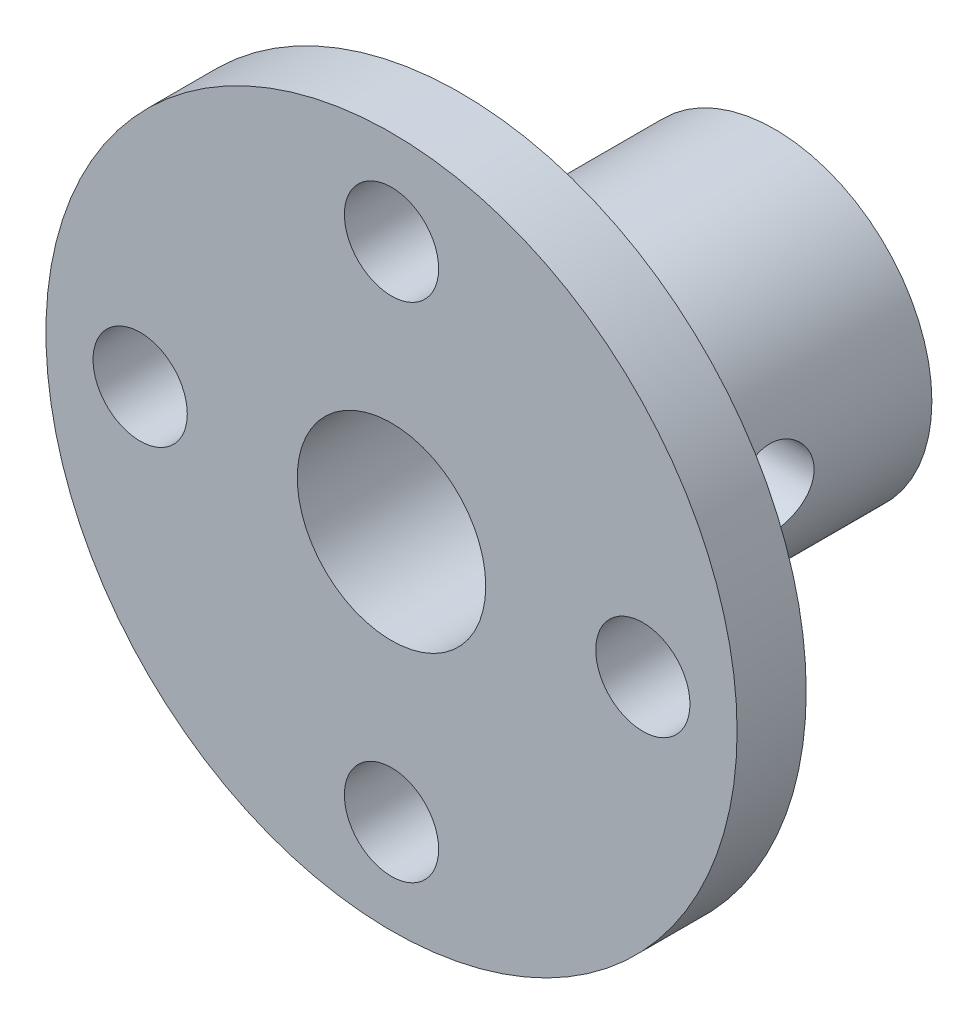
from build123d import *

# Parameters (mm, degrees)
SKETCH_1_R                           = 5
SKETCH_1_R_2                         = 3
HUB_OD10_ID6_L10_DEPTH               = 10
SKETCH_2_R                           = 11
SKETCH_2_R_2                         = 3
FLANGE_OD22_T2P2_DEPTH               = 2.2
SKETCH_3_R                           = 1.5
F_4XD3_ON_PCD16_DEPTH                = 2.2
SKETCH_4_R                           = 1.25
M3_GRUB_SCREW_RADIAL_REFERENCE_DEPTH = 2.1


with BuildPart() as part:
    # 草图1 → Hub_OD10_ID6_L10 (new body)
    with BuildSketch(Plane.XY):
        Circle(SKETCH_1_R)
        Circle(SKETCH_1_R_2, mode=Mode.SUBTRACT)
    extrude(amount=HUB_OD10_ID6_L10_DEPTH)

    # 草图2 → Flange_OD22_T2p2 (add)
    with BuildSketch(Plane.XY.offset(10)):
        Circle(SKETCH_2_R)
        Circle(SKETCH_2_R_2, mode=Mode.SUBTRACT)
    extrude(amount=FLANGE_OD22_T2P2_DEPTH)

    # 草图3 → 4xD3_on_PCD16 (cut)
    with BuildSketch(Plane.XY.offset(12.2)):
        with Locations((8, 0)):
            Circle(SKETCH_3_R)
        with Locations((0, 8)):
            Circle(SKETCH_3_R)
        with Locations((-8, 0)):
            Circle(SKETCH_3_R)
        with Locations((0, -8)):
            Circle(SKETCH_3_R)
    extrude(amount=-F_4XD3_ON_PCD16_DEPTH, mode=Mode.SUBTRACT)

    # 草图4 → M3_grub_screw_radial_reference (cut)
    with BuildSketch(Plane(origin=(5, 0, 0), x_dir=(0, 0, -1), z_dir=(1, 0, 0))):
        with Locations((-5, 0)):
            Circle(SKETCH_4_R)
    extrude(amount=-M3_GRUB_SCREW_RADIAL_REFERENCE_DEPTH, mode=Mode.SUBTRACT)


solid = part.part
